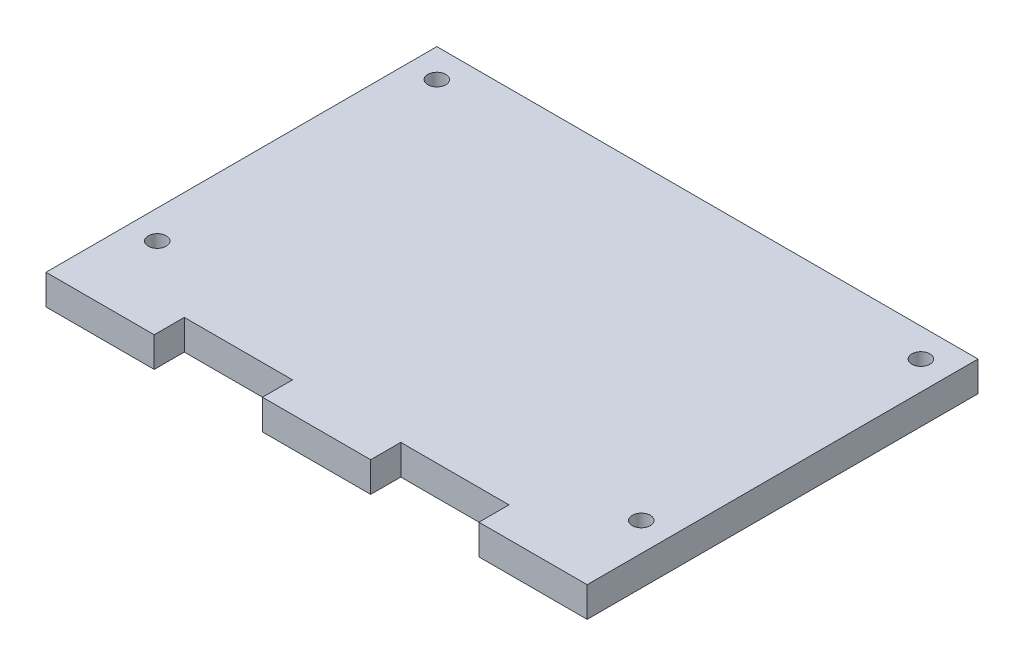
from build123d import *

# Parameters (mm, degrees)
BOSS_EXTRUDE1_DEPTH = 5
SKETCH2_R           = 1.5
CUT_EXTRUDE1_DEPTH  = 5


with BuildPart() as part:
    # Sketch1 → Boss-Extrude1 (new body)
    with BuildSketch(Plane(origin=(0, 0, 0), x_dir=(1, 0, 0), z_dir=(0, 1, 0))):
        Polygon((54, 0), (72, 0), (72, -5), (90, -5), (90, 0), (90, 60), (0, 60), (0, 0), (0, -5), (18, -5), (18, 0), (36, 0), (36, -5), (54, -5), align=None)
    extrude(amount=BOSS_EXTRUDE1_DEPTH)

    # Sketch2 → Cut-Extrude1 (cut)
    with BuildSketch(Plane(origin=(0, 5, 0), x_dir=(1, 0, 0), z_dir=(0, 1, 0))):
        with Locations(Location((4.75, 55.25, 0), (0, 0, 270))):
            Circle(SKETCH2_R)
        with Locations(Location((85.25, 55.25, 0), (0, 0, 270))):
            Circle(SKETCH2_R)
        with Locations(Location((85.25, 8.75, 0), (0, 0, 270))):
            Circle(SKETCH2_R)
        with Locations(Location((4.75, 8.75, 0), (0, 0, 270))):
            Circle(SKETCH2_R)
    extrude(amount=-CUT_EXTRUDE1_DEPTH, mode=Mode.SUBTRACT)


solid = part.part
